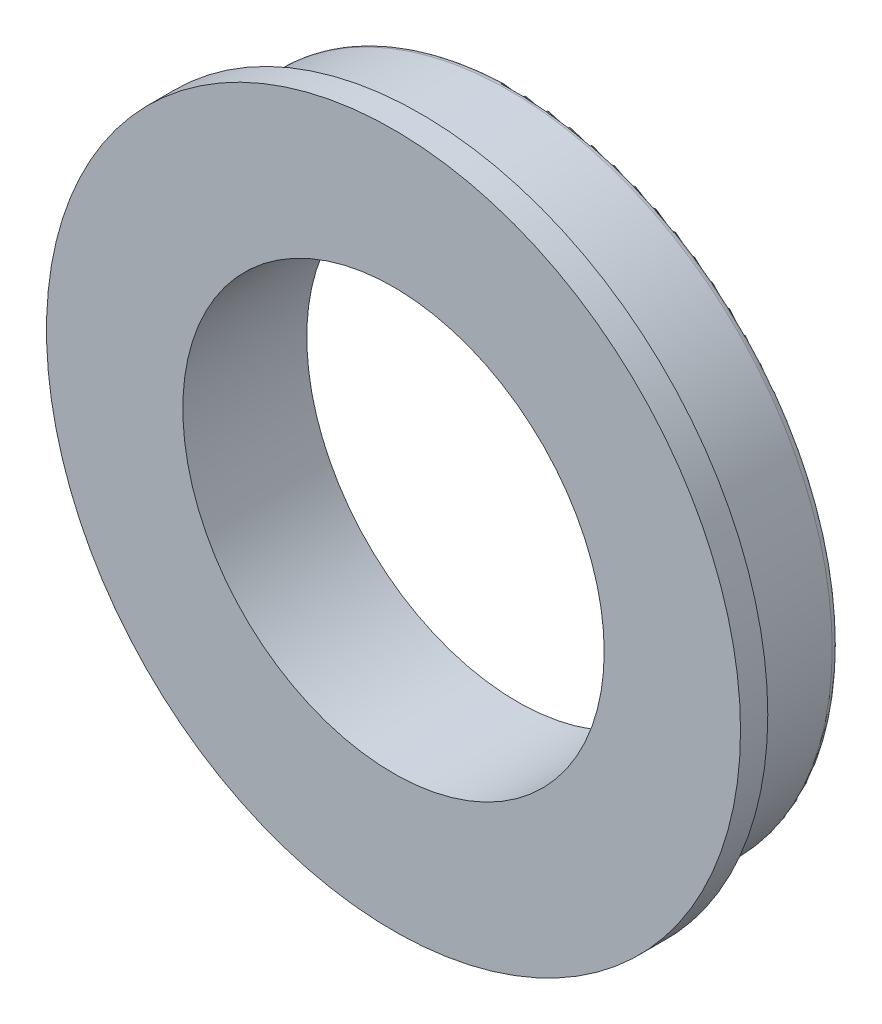
from build123d import *

# Parameters (mm, degrees)
SKETCH_1_R      = 13
SKETCH_1_R_2    = 8.5
EXTRUDE_1_DEPTH = 5
EXTRUDE_START   = -1.1
SKETCH_2_R      = 14
SKETCH_2_R_2    = 13
EXTRUDE_2_DEPTH = 1.1
FILLET_1_R      = 0.3


with BuildPart() as part:
    # 草图1 → 凸台-拉伸1 (new body)
    with BuildSketch(Plane.XY):
        Circle(SKETCH_1_R)
        Circle(SKETCH_1_R_2, mode=Mode.SUBTRACT)
    extrude(amount=EXTRUDE_1_DEPTH)

    # 草图2 → 凸台-拉伸2 (add)
    with BuildSketch(Plane.XY.offset(5).offset(EXTRUDE_START)):
        Circle(SKETCH_2_R)
        Circle(SKETCH_2_R_2, mode=Mode.SUBTRACT)
    extrude(amount=EXTRUDE_2_DEPTH)

    # 圆角1
    fillet_1_edges = [part.edges().sort_by_distance(p)[0] for p in [
        (-13, 0, 0),
    ]]
    fillet(fillet_1_edges, radius=FILLET_1_R)


solid = part.part
